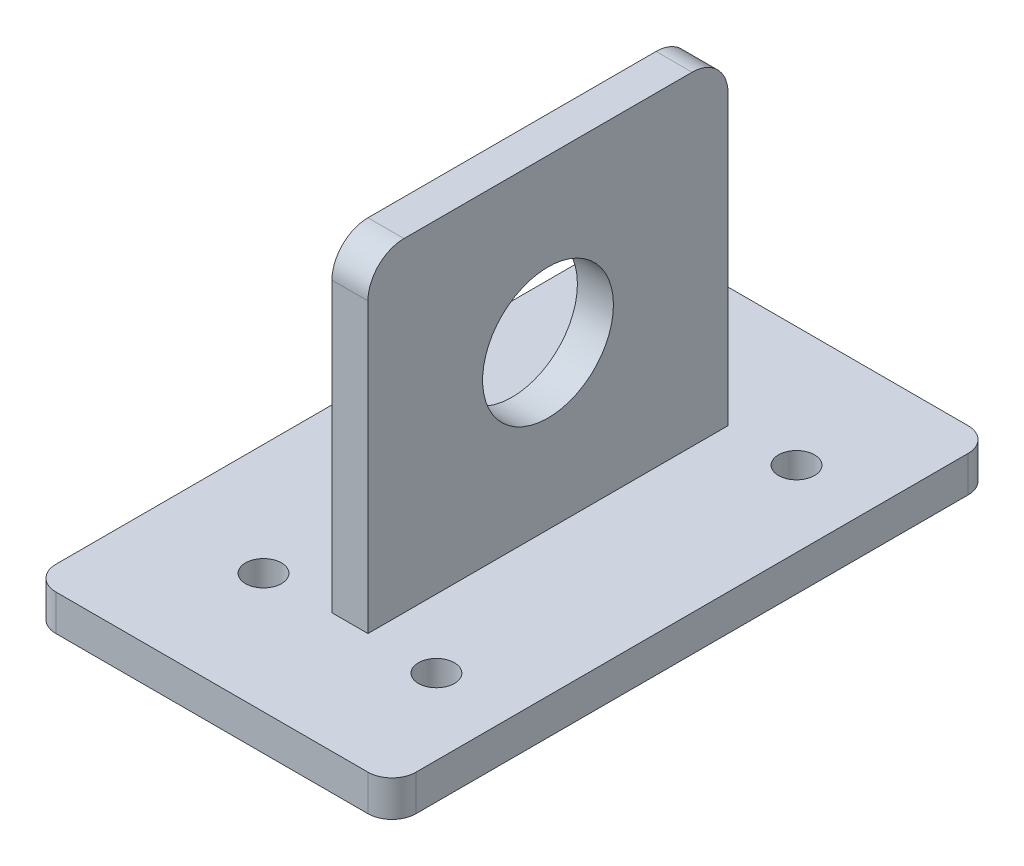
from build123d import *

# Parameters (mm, degrees)
SKETCH_1_W               = 30
SKETCH_1_H               = 50
EXTRUDE_1_DEPTH          = 3
SKETCH_2_W               = 30
SKETCH_2_H               = 30
EXTRUDE_2_DEPTH          = 3
SKETCH_3_R               = 5.45
CUT_EXTRUDE_1_DEPTH      = 3
FILLET_1_R               = 2
FILLET_2_R               = 3
SKETCH_4_R               = 1.5
CUT_EXTRUDE_2_DEPTH      = 3
MIRROR_2_COPY_1_SKETCH_R = 1.5
MIRROR_2_COPY_1_DEPTH    = 3


with BuildPart() as part:
    # 草图1 → 凸台-拉伸1 (new body)
    with BuildSketch(Plane(origin=(0, 0, 0), x_dir=(1, 0, 0), z_dir=(0, 1, 0))):
        Rectangle(SKETCH_1_W, SKETCH_1_H)
    extrude(amount=EXTRUDE_1_DEPTH)

    # 草图2 → 凸台-拉伸2 (add)
    with BuildSketch(Plane(origin=(0, 0, 0), x_dir=(0, 0, -1), z_dir=(1, 0, 0))):
        with Locations((0, 15)):
            Rectangle(SKETCH_2_W, SKETCH_2_H)
    extrude(amount=EXTRUDE_2_DEPTH)

    # 草图3 → 切除-拉伸1 (cut)
    with BuildSketch(Plane(origin=(3, 0, 0), x_dir=(0, 0, -1), z_dir=(1, 0, 0))):
        with Locations((0, 16.5)):
            Circle(SKETCH_3_R)
    extrude(amount=-CUT_EXTRUDE_1_DEPTH, mode=Mode.SUBTRACT)

    # 圆角1
    fillet_1_edges = [part.edges().sort_by_distance(p)[0] for p in [
        (-15, 1.5, -25),
        (15, 1.5, -25),
        (15, 1.5, 25),
        (-15, 1.5, 25),
    ]]
    fillet(fillet_1_edges, radius=FILLET_1_R)

    # 圆角2
    fillet_2_edges = [part.edges().sort_by_distance(p)[0] for p in [
        (1.5, 30, 15),
        (1.5, 30, -15),
    ]]
    fillet(fillet_2_edges, radius=FILLET_2_R)

    # 草图4 → 切除-拉伸2 (cut)
    with BuildSketch(Plane(origin=(0, 3, 0), x_dir=(1, 0, 0), z_dir=(0, 1, 0))):
        with Locations(Location((-5.70350483, 15, 0), (0, 0, 270))):
            Circle(SKETCH_4_R)
    cut_extrude_2 = extrude(amount=-CUT_EXTRUDE_2_DEPTH, mode=Mode.SUBTRACT)

    # 镜向1: 切除-拉伸2 across plane
    add(cut_extrude_2.mirror(Plane.XY), mode=Mode.SUBTRACT)

    # 镜向2: 切除-拉伸2 across plane
    add(cut_extrude_2.mirror(Plane(origin=(1.5, 0, 0), x_dir=(0, 0, 1), z_dir=(1, 0, 0))), mode=Mode.SUBTRACT)

    # 镜向2 copy 1 sketch → 镜向2 copy 1 (cut)
    with BuildSketch(Plane(origin=(3, 3, 0), x_dir=(-1, 0, 0), z_dir=(0, 1, 0))):
        with Locations(Location((-5.70350483, 15, 0), (0, 0, 270))):
            Circle(MIRROR_2_COPY_1_SKETCH_R)
    extrude(amount=-MIRROR_2_COPY_1_DEPTH, mode=Mode.SUBTRACT)


solid = part.part
